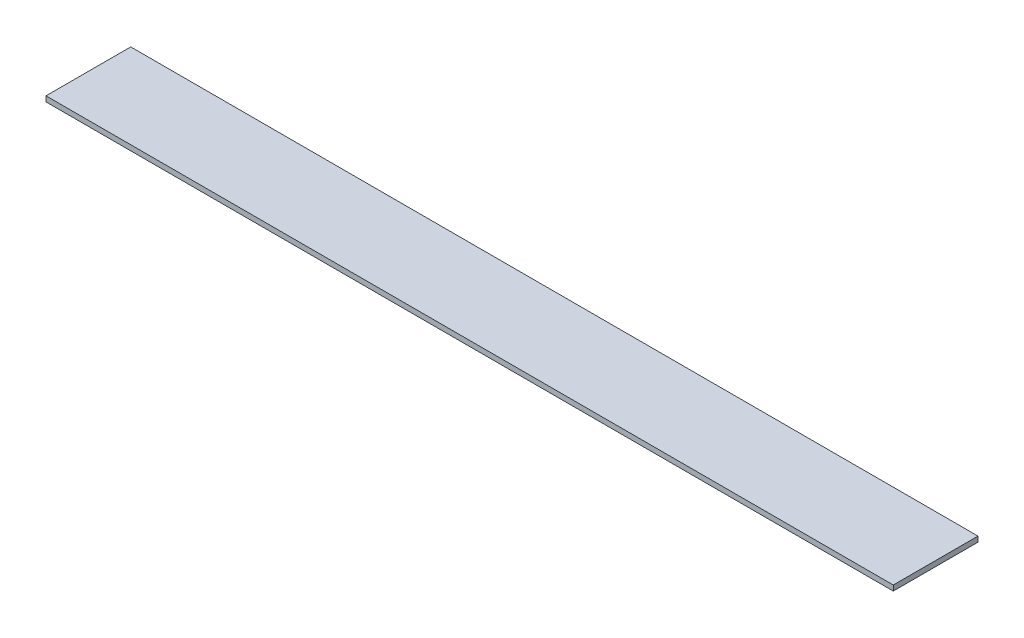
from build123d import *

# Parameters (mm, degrees)
SKETCH1_W           = 254
SKETCH1_H           = 25.4
BOSS_EXTRUDE1_DEPTH = 1.5875


with BuildPart() as part:
    # Sketch1 → Boss-Extrude1 (new body)
    with BuildSketch(Plane(origin=(0, 0, 0), x_dir=(1, 0, 0), z_dir=(0, 1, 0))):
        Rectangle(SKETCH1_W, SKETCH1_H)
    extrude(amount=BOSS_EXTRUDE1_DEPTH)


solid = part.part
